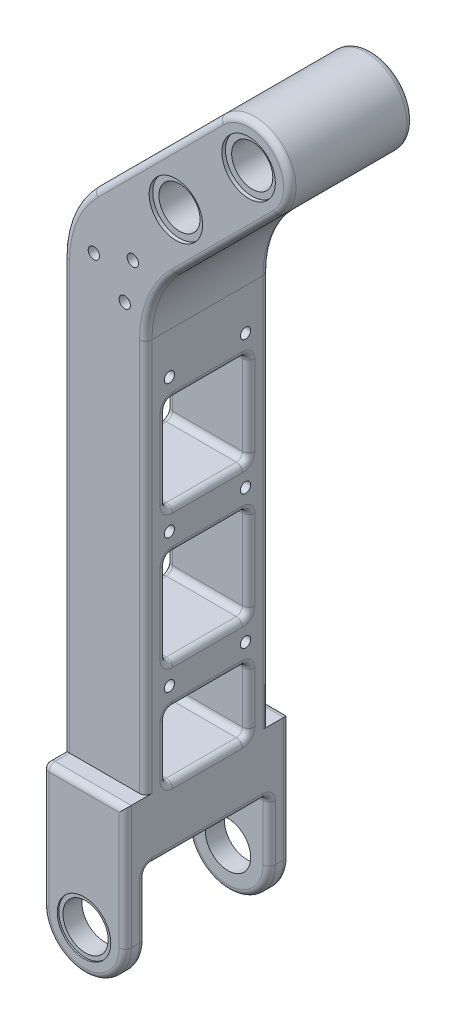
from build123d import *

# Parameters (mm, degrees)
SKETCH_1_R             = 20
SKETCH_1_R_2           = 10
EXTRUDE_1_DEPTH        = 60
EXTRUDE_2_DEPTH        = 30
SKETCH_4_R             = 11
EXTRUDE_3_DEPTH        = 10
SKETCH_8_R             = 10
CUT_EXTRUDE_1_DEPTH    = 100
FILLET_1_R             = 50
FILLET_2_R             = 3
SKETCH_9_R             = 13
CUT_EXTRUDE_2_DEPTH    = 0.75
CUT_EXTRUDE_START      = -0.75
SKETCH_10_R            = 13
CUT_EXTRUDE_3_DEPTH    = 0.75
SKETCH_11_R            = 2.5
CUT_EXTRUDE_4_DEPTH    = 393.300904947
SKETCH_12_W            = 40
SKETCH_12_H            = 45
SKETCH_12_H_2          = 31.005050634
CUT_EXTRUDE_5428_DEPTH = 393.300904947
FILLET_3_R             = 3
SKETCH_13_R            = 13
CUT_EXTRUDE_6_DEPTH    = 1.75
CUT_EXTRUDE_START_2    = -1.75
SKETCH_14_R            = 13
CUT_EXTRUDE_7_DEPTH    = 1.75
SKETCH_15_R            = 2.75
CUT_EXTRUDE_8_DEPTH    = 388.169213652


with BuildPart() as part:
    # 草图1 → 凸台-拉伸1 (new body)
    with BuildSketch(Plane.XY):
        Circle(SKETCH_1_R)
        Circle(SKETCH_1_R_2, mode=Mode.SUBTRACT)
    extrude(amount=EXTRUDE_1_DEPTH)

    # 草图2 → 凸台-拉伸2 (add, symmetric)
    with BuildSketch(Plane.XY.offset(30)):
        with BuildLine():
            Line((-14.142135624, 14.142135624), (-90, -61.715728753))
            Line((-90, -61.715728753), (-90, -320))
            Line((-90, -320), (-50, -320))
            Line((-50, -320), (-50, -78.284271247))
            Line((-50, -78.284271247), (14.142135624, -14.142135624))
            ThreePointArc((14.142135624, -14.142135624), (-14.142135624, -14.142135624), (-14.142135624, 14.142135624))
        make_face()
    extrude(amount=EXTRUDE_2_DEPTH, both=True)

    # 草图4 → 凸台-拉伸3 (add)
    with BuildSketch(Plane.XY.offset(60)):
        with BuildLine():
            Line((-90, -290), (-50, -290))
            Line((-50, -290), (-50, -350))
            ThreePointArc((-50, -350), (-70, -370), (-90, -350))
            Line((-90, -350), (-90, -290))
        make_face()
        with Locations((-70, -350)):
            Circle(SKETCH_4_R, mode=Mode.SUBTRACT)
    extrude_3 = extrude(amount=EXTRUDE_3_DEPTH)

    # 镜向1: 凸台-拉伸3 across plane
    add(extrude_3.mirror(Plane.XY.offset(30)))

    # 草图8 → 切除-拉伸1 (cut)
    with BuildSketch(Plane.XY.offset(60)):
        with Locations((-35.355339059, -35.355339059)):
            Circle(SKETCH_8_R)
    extrude(amount=-CUT_EXTRUDE_1_DEPTH, mode=Mode.SUBTRACT)

    # 圆角1
    fillet_1_edges = [part.edges().sort_by_distance(p)[0] for p in [
        (-50, -78.284271247, 30),
        (-90, -61.715728753, 30),
    ]]
    fillet(fillet_1_edges, radius=FILLET_1_R)

    # 圆角2
    fillet_2_edges = [part.edges().sort_by_distance(p)[0] for p in [
        (14.142135624, 14.142135624, 60),
        (14.142135624, 14.142135624, 0),
        (-10.606601718, -38.890872965, 60),
        (-44.748737342, -16.464466094, 0),
        (-70, -320, 0),
        (-90, -320, 30),
        (-50, -320, 30),
        (-44.748737342, -16.464466094, 60),
        (-70, -320, 60),
        (-10.606601718, -38.890872965, 0),
        (-90, -320, 70),
        (-70, -370, 70),
        (-50, -320, 70),
        (-70, -290, 70),
        (-90, -335, 60),
        (-90, -290, 65),
        (-70, -370, 60),
        (-50, -335, 60),
        (-90, -320, -10),
        (-70, -290, -10),
        (-90, -290, -5),
        (-50, -320, -10),
        (-70, -370, -10),
        (-90, -335, 0),
        (-70, -370, 0),
        (-50, -335, 0),
        (-90, -186.213203436, 0),
        (-90, -186.213203436, 60),
        (-50, -194.497474683, 0),
        (-86.193976626, -63.292235253, 0),
        (-50, -194.497474683, 60),
        (-86.193976626, -63.292235253, 60),
        (-46.193976626, -79.860777748, 0),
        (-46.193976626, -79.860777748, 60),
    ]]
    fillet(fillet_2_edges, radius=FILLET_2_R)

    # 草图9 → 切除-拉伸2 (cut)
    with BuildSketch(Plane.XY.offset(70)):
        with Locations((-70, -350)):
            Circle(SKETCH_9_R)
    extrude(amount=-CUT_EXTRUDE_2_DEPTH, mode=Mode.SUBTRACT)

    # 草图10 → 切除-拉伸3 (cut)
    with BuildSketch(Plane(origin=(0, 0, -10), x_dir=(-1, 0, 0), z_dir=(0, 0, -1)).offset(CUT_EXTRUDE_START)):
        with Locations(Location((70, -350, 0), (0, 0, 180))):
            Circle(SKETCH_10_R)
    extrude(amount=CUT_EXTRUDE_3_DEPTH, mode=Mode.SUBTRACT)

    # 草图11 → 切除-拉伸4 (cut, through all)
    with BuildSketch(Plane.ZY.offset(90)):
        with Locations(Location((48.5, -183.994949366, 0), (0, 0, 270))):
            Circle(SKETCH_11_R)
        with Locations(Location((48.5, -248.994949366, 0), (0, 0, 270))):
            Circle(SKETCH_11_R)
        with Locations(Location((48.5, -118.994949366, 0), (0, 0, 270))):
            Circle(SKETCH_11_R)
        with Locations(Location((11.5, -248.994949366, 0), (0, 0, 270))):
            Circle(SKETCH_11_R)
        with Locations(Location((11.5, -183.994949366, 0), (0, 0, 270))):
            Circle(SKETCH_11_R)
        with Locations(Location((11.5, -118.994949366, 0), (0, 0, 270))):
            Circle(SKETCH_11_R)
    extrude(amount=-CUT_EXTRUDE_4_DEPTH, mode=Mode.SUBTRACT)

    # 草图12 → Cut-Extrude 5428 (cut, through all)
    with BuildSketch(Plane.ZY.offset(90)):
        with Locations((30, -151.494949366)):
            Rectangle(SKETCH_12_W, SKETCH_12_H)
        with Locations((30, -216.494949366)):
            Rectangle(SKETCH_12_W, SKETCH_12_H)
        with Locations((30, -274.497474683)):
            Rectangle(SKETCH_12_W, SKETCH_12_H_2)
    extrude(amount=-CUT_EXTRUDE_5428_DEPTH, mode=Mode.SUBTRACT)

    # 圆角3
    fillet_3_edges = [part.edges().sort_by_distance(p)[0] for p in [
        (-50, -216.494949366, 10),
        (-50, -238.994949366, 30),
        (-50, -216.494949366, 50),
        (-50, -193.994949366, 30),
        (-50, -274.497474683, 10),
        (-50, -290, 30),
        (-50, -274.497474683, 50),
        (-50, -258.994949366, 30),
        (-50, -151.494949366, 50),
        (-50, -128.994949366, 30),
        (-50, -151.494949366, 10),
        (-50, -173.994949366, 30),
        (-70, -173.994949366, 50),
        (-70, -173.994949366, 10),
        (-70, -128.994949366, 10),
        (-90, -128.994949366, 30),
        (-70, -128.994949366, 50),
        (-90, -151.494949366, 50),
        (-90, -173.994949366, 30),
        (-90, -151.494949366, 10),
        (-70, -258.994949366, 10),
        (-90, -258.994949366, 30),
        (-70, -258.994949366, 50),
        (-90, -274.497474683, 50),
        (-70, -290, 50),
        (-70, -290, 10),
        (-90, -274.497474683, 10),
        (-90, -290, 30),
        (-70, -193.994949366, 10),
        (-90, -193.994949366, 30),
        (-70, -193.994949366, 50),
        (-90, -216.494949366, 50),
        (-70, -238.994949366, 50),
        (-70, -238.994949366, 10),
        (-90, -216.494949366, 10),
        (-90, -238.994949366, 30),
    ]]
    fillet(fillet_3_edges, radius=FILLET_3_R)

    # 草图13 → 切除-拉伸6 (cut)
    with BuildSketch(Plane.XY.offset(60)):
        Circle(SKETCH_13_R)
        with Locations((-35.355339059, -35.355339059)):
            Circle(SKETCH_13_R)
    extrude(amount=-CUT_EXTRUDE_6_DEPTH, mode=Mode.SUBTRACT)

    # 草图14 → 切除-拉伸7 (cut)
    with BuildSketch(Plane(origin=(0, 0, 0), x_dir=(-1, 0, 0), z_dir=(0, 0, -1)).offset(CUT_EXTRUDE_START_2)):
        with Locations(Location((0, 0, 0), (0, 0, 180))):
            Circle(SKETCH_14_R)
        with Locations(Location((35.355339059, -35.355339059, 0), (0, 0, 180))):
            Circle(SKETCH_14_R)
    extrude(amount=CUT_EXTRUDE_7_DEPTH, mode=Mode.SUBTRACT)

    # 草图15 → 切除-拉伸8 (cut, through all)
    with BuildSketch(Plane(origin=(0, 0, 0), x_dir=(-1, 0, 0), z_dir=(0, 0, -1))):
        with Locations((60.194193243, -86.812146645)):
            Circle(SKETCH_15_R)
        with Locations((56.27187054, -67.200533131)):
            Circle(SKETCH_15_R)
        with Locations((75.217187404, -73.609508785)):
            Circle(SKETCH_15_R)
    extrude(amount=-CUT_EXTRUDE_8_DEPTH, mode=Mode.SUBTRACT)


solid = part.part
